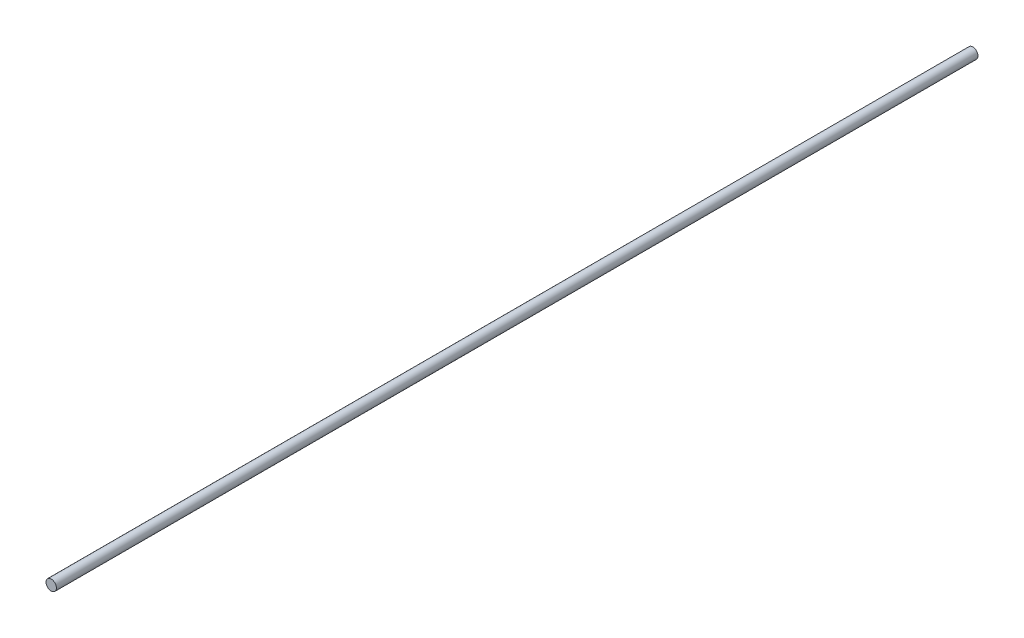
from build123d import *

# Parameters (mm, degrees)
SKETCH1_R           = 6.35
BOSS_EXTRUDE1_DEPTH = 1122.137625954


with BuildPart() as part:
    # Sketch1 → Boss-Extrude1 (new body)
    with BuildSketch(Plane.XY):
        Circle(SKETCH1_R)
    extrude(amount=-BOSS_EXTRUDE1_DEPTH)


solid = part.part
